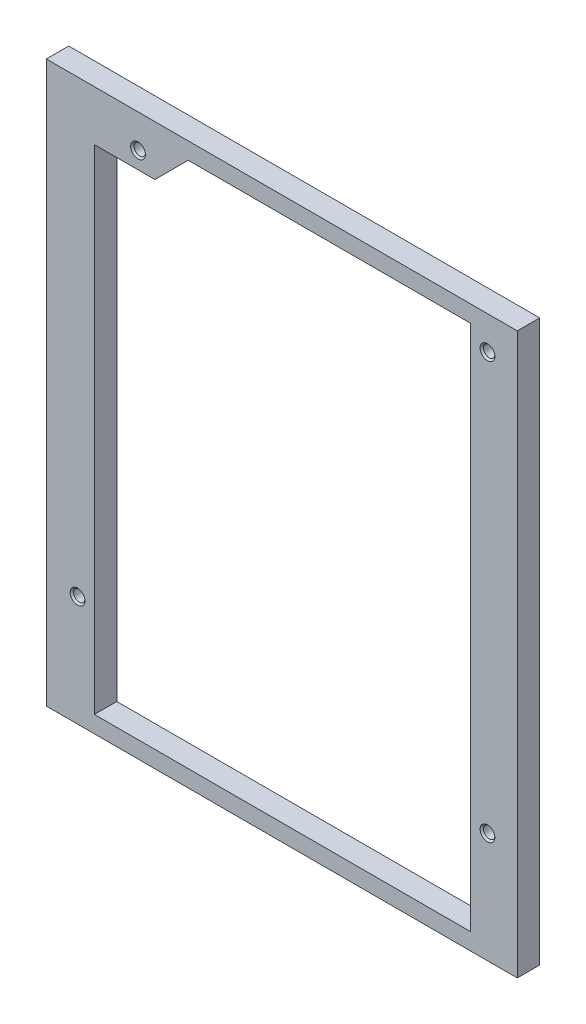
from build123d import *

# Parameters (mm, degrees)
SKETCH3_W                              = 178.001
SKETCH3_H                              = 211.818599984
BOSS_EXTRUDE1_DEPTH                    = 8.466666582
F_18_0_1695_DIAMETER_HOLE1_D           = 4.3053
F_18_0_1695_DIAMETER_HOLE1_CSINK_D     = 5.5753
F_18_0_1695_DIAMETER_HOLE1_CSINK_ANGLE = 90
CUT_EXTRUDE1_DEPTH                     = 5.08
CUT_EXTRUDE2_DEPTH                     = 5.08
CHAMFER1_SIZE                          = 0.635


with BuildPart() as part:
    # Sketch3 → Boss-Extrude1 (new body)
    with BuildSketch(Plane.XY):
        with Locations((2.3495, -14.559299992)):
            Rectangle(SKETCH3_W, SKETCH3_H)
        Polygon((-33.01966, 85), (73.75034, 85), (73.75034, -114.118599984), (-68.48966, -114.118599984), (-68.48966, 72.39), (-45.62966, 72.39), align=None, mode=Mode.SUBTRACT)
    extrude(amount=-BOSS_EXTRUDE1_DEPTH)

    # #18 (0.1695) Diameter Hole1 (through all)
    with Locations(Plane(origin=(0, 0, 0), x_dir=(-1, 0, 0), z_dir=(0, 0, 1))):
        with Locations((51.97966, -78.74), (74.83966, 78.74), (-80.10034, 78.74), (-80.10034, -78.74)):
            CounterSinkHole(F_18_0_1695_DIAMETER_HOLE1_D / 2, F_18_0_1695_DIAMETER_HOLE1_CSINK_D / 2, counter_sink_angle=F_18_0_1695_DIAMETER_HOLE1_CSINK_ANGLE)

    # Sketch9 → Cut-Extrude1 (cut)
    with BuildSketch(Plane.ZY.offset(86.651)):
        Polygon((-4.233333333, -65.0886), (-1.058333333, -68.2636), (-4.233333333, -71.4386), (-7.408333333, -68.2636), align=None)
        Polygon((-4.233333333, 90.291666667), (-1.058333333, 87.116666667), (-4.233333333, 83.941666667), (-7.408333333, 87.116666667), align=None)
    extrude(amount=-CUT_EXTRUDE1_DEPTH, mode=Mode.SUBTRACT)

    # Sketch10 → Cut-Extrude2 (cut)
    with BuildSketch(Plane.XZ.offset(120.468599984)):
        Polygon((-85.592666667, -4.233333333), (-82.417666667, -1.058333333), (-79.242666667, -4.233333333), (-82.417666667, -7.408333333), align=None)
        Polygon((83.941666667, -4.233333333), (87.116666667, -1.058333333), (90.291666667, -4.233333333), (87.116666667, -7.408333333), align=None)
    extrude(amount=-CUT_EXTRUDE2_DEPTH, mode=Mode.SUBTRACT)

    # Chamfer1
    chamfer1_edges = [part.edges().sort_by_distance(p)[0] for p in [
        (88.704166667, -115.388599984, -2.645833333),
        (88.704166667, -115.388599984, -5.820833333),
        (85.529166667, -120.468599984, -5.820833333),
        (88.704166667, -120.468599984, -5.820833333),
        (88.704166667, -120.468599984, -2.645833333),
        (85.529166667, -120.468599984, -2.645833333),
        (-81.571, -66.6761, -5.820833333),
        (-81.571, -66.6761, -2.645833333),
        (-81.571, -69.8511, -2.645833333),
        (-81.571, -69.8511, -5.820833333),
        (-86.651, -66.6761, -5.820833333),
        (-86.651, -69.8511, -5.820833333),
        (-86.651, -69.8511, -2.645833333),
        (-86.651, -66.6761, -2.645833333),
        (-81.571, 88.704166667, -5.820833333),
        (-81.571, 88.704166667, -2.645833333),
        (-81.571, 85.529166667, -2.645833333),
        (-81.571, 85.529166667, -5.820833333),
        (-86.651, 88.704166667, -5.820833333),
        (-86.651, 85.529166667, -5.820833333),
        (-86.651, 85.529166667, -2.645833333),
        (-86.651, 88.704166667, -2.645833333),
        (-84.005166667, -115.388599984, -5.820833333),
        (-84.005166667, -115.388599984, -2.645833333),
        (-80.830166667, -115.388599984, -2.645833333),
        (-80.830166667, -115.388599984, -5.820833333),
        (-84.005166667, -120.468599984, -5.820833333),
        (-80.830166667, -120.468599984, -5.820833333),
        (-80.830166667, -120.468599984, -2.645833333),
        (-84.005166667, -120.468599984, -2.645833333),
        (85.529166667, -115.388599984, -5.820833333),
        (85.529166667, -115.388599984, -2.645833333),
    ]]
    chamfer(chamfer1_edges, length=CHAMFER1_SIZE)


solid = part.part
